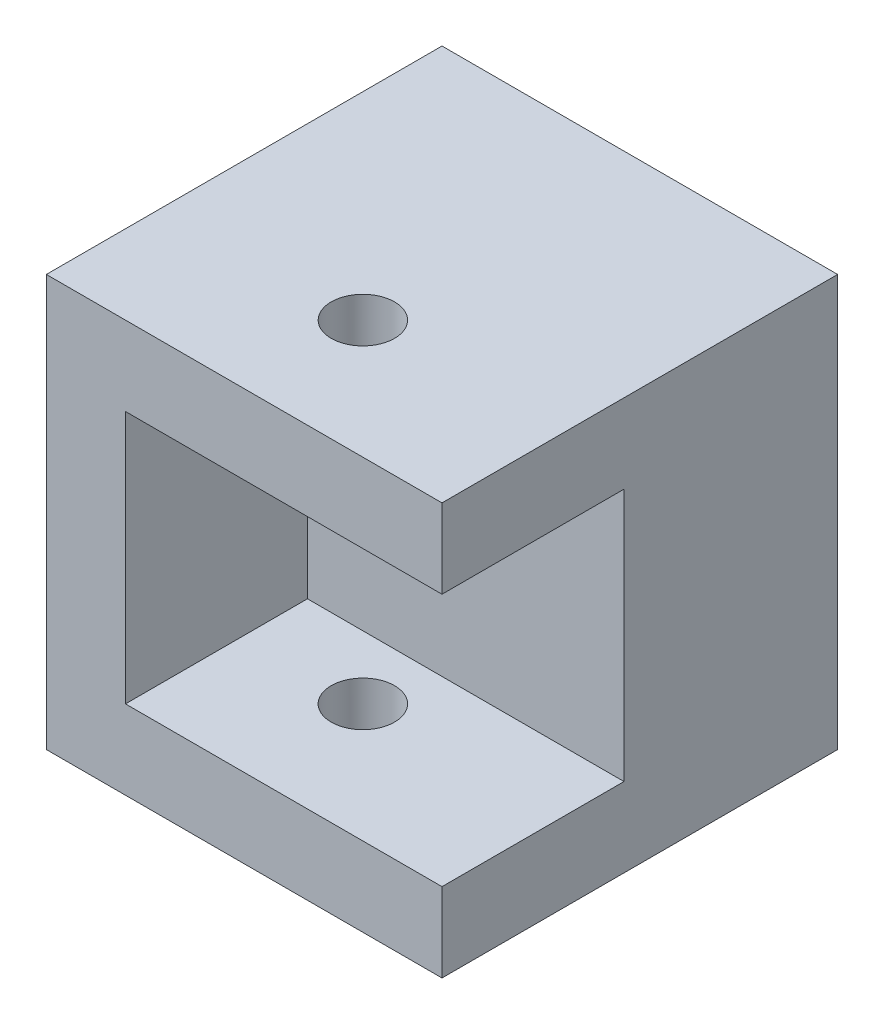
from build123d import *

# Parameters (mm, degrees)
BOSS_EXTRUDE1_DEPTH = 25
SKETCH3_R           = 2
CUT_EXTRUDE1_DEPTH  = 15
SKETCH2_W           = 4
SKETCH2_H           = 26
BOSS_EXTRUDE2_DEPTH = 20
SKETCH7_W           = 15
SKETCH7_H           = 5
BOSS_EXTRUDE4_DEPTH = 25
CUT_EXTRUDE2_DEPTH  = 20
BOSS_EXTRUDE5_DEPTH = 4
CUT_EXTRUDE3_START  = -10
SKETCH10_R          = 2
CUT_EXTRUDE3_DEPTH  = 10
SKETCH11_W          = 15
SKETCH11_H          = 15
BOSS_EXTRUDE6_DEPTH = 14
SKETCH14_W          = 15
SKETCH14_H          = 15
CUT_EXTRUDE5_DEPTH  = 0.5
BOSS_EXTRUDE7_DEPTH = 5
SKETCH13_R          = 2
CUT_EXTRUDE6_DEPTH  = 10
SKETCH17_W          = 20
SKETCH17_H          = 11.5
CUT_EXTRUDE7_DEPTH  = 1


with BuildPart() as part:
    # Sketch1 → Boss-Extrude1 (new body)
    with BuildSketch(Plane.XY):
        Polygon((15.200344072, 13.760447293), (0.200344072, 13.760447293), (0.200344072, -6.239552707), (-4.799655928, -6.239552707), (-4.799655928, 19.760447293), (15.200344072, 19.760447293), align=None)
    extrude(amount=BOSS_EXTRUDE1_DEPTH)

    # Sketch3 → Cut-Extrude1 (cut)
    with BuildSketch(Plane.XZ.offset(-13.760447293)):
        with Locations((7.700344072, 21.5)):
            Circle(SKETCH3_R)
    extrude(amount=-CUT_EXTRUDE1_DEPTH, mode=Mode.SUBTRACT)

    # Sketch2 → Boss-Extrude2 (add)
    with BuildSketch(Plane.ZY.offset(4.799655928)):
        with Locations((2, 6.760447293)):
            Rectangle(SKETCH2_W, SKETCH2_H)
    extrude(amount=-BOSS_EXTRUDE2_DEPTH)

    # Sketch7 → Boss-Extrude4 (add)
    with BuildSketch(Plane.XY.offset(4)):
        with Locations((7.700344072, -3.739552707)):
            Rectangle(SKETCH7_W, SKETCH7_H)
    extrude(amount=BOSS_EXTRUDE4_DEPTH)

    # Sketch8 → Cut-Extrude2 (cut)
    with BuildSketch(Plane(origin=(15.200344072, 0, 0), x_dir=(0, 0, -1), z_dir=(1, 0, 0))):
        Polygon((-4, -1.239552707), (-4, -6.239552707), (0, -6.239552707), (0, 19.760447293), (-4, 19.760447293), (-4, 13.760447293), align=None)
    extrude(amount=-CUT_EXTRUDE2_DEPTH, mode=Mode.SUBTRACT)

    # Sketch9 → Boss-Extrude5 (add)
    with BuildSketch(Plane.XY.offset(25)):
        Polygon((15.200344072, 13.760447293), (15.200344072, 19.760447293), (-4.799655928, 19.760447293), (-4.799655928, -6.239552707), (0.200344072, -6.239552707), (0.200344072, -1.239552707), (0.200344072, 13.760447293), align=None)
    extrude(amount=BOSS_EXTRUDE5_DEPTH)

    # Sketch10 → Cut-Extrude3 (cut)
    with BuildSketch(Plane(origin=(0, -1.239552707, 0), x_dir=(1, 0, 0), z_dir=(0, 1, 0)).offset(CUT_EXTRUDE3_START)):
        with Locations((7.700344072, -21.5)):
            Circle(SKETCH10_R)
    extrude(amount=CUT_EXTRUDE3_DEPTH, mode=Mode.SUBTRACT)

    # Sketch11 → Boss-Extrude6 (add)
    with BuildSketch(Plane(origin=(0, 0, 4), x_dir=(-1, 0, 0), z_dir=(0, 0, -1))):
        with Locations((-7.700344072, 6.260447293)):
            Rectangle(SKETCH11_W, SKETCH11_H)
    extrude(amount=-BOSS_EXTRUDE6_DEPTH)

    # Sketch14 → Cut-Extrude5 (cut)
    with BuildSketch(Plane.XY.offset(18)):
        with Locations((7.700344072, 6.260447293)):
            Rectangle(SKETCH14_W, SKETCH14_H)
    extrude(amount=-CUT_EXTRUDE5_DEPTH, mode=Mode.SUBTRACT)

    # Sketch16 → Boss-Extrude7 (add)
    with BuildSketch(Plane(origin=(15.200344072, 0, 0), x_dir=(0, 0, -1), z_dir=(1, 0, 0))):
        Polygon((-29, 13.760447293), (-17.5, 13.760447293), (-17.5, -1.239552707), (-29, -1.239552707), (-29, -6.239552707), (-4, -6.239552707), (-4, 19.760447293), (-29, 19.760447293), align=None)
    extrude(amount=BOSS_EXTRUDE7_DEPTH)

    # Sketch13 → Cut-Extrude6 (cut)
    with BuildSketch(Plane(origin=(0, 0, 4), x_dir=(-1, 0, 0), z_dir=(0, 0, -1))):
        with Locations(Location((-14.700344072, -0.239552707, 0), (0, 0, 90))):
            Circle(SKETCH13_R)
        with Locations(Location((-14.700344072, 13.760447293, 0), (0, 0, 90))):
            Circle(SKETCH13_R)
        with Locations(Location((-0.700344072, 13.760447293, 0), (0, 0, 90))):
            Circle(SKETCH13_R)
        with Locations(Location((-0.700344072, -0.239552707, 0), (0, 0, 90))):
            Circle(SKETCH13_R)
    extrude(amount=-CUT_EXTRUDE6_DEPTH, mode=Mode.SUBTRACT)

    # Sketch17 → Cut-Extrude7 (cut)
    with BuildSketch(Plane.XZ.offset(-13.760447293)):
        with Locations((10.200344072, 23.25)):
            Rectangle(SKETCH17_W, SKETCH17_H)
    extrude(amount=-CUT_EXTRUDE7_DEPTH, mode=Mode.SUBTRACT)


solid = part.part
